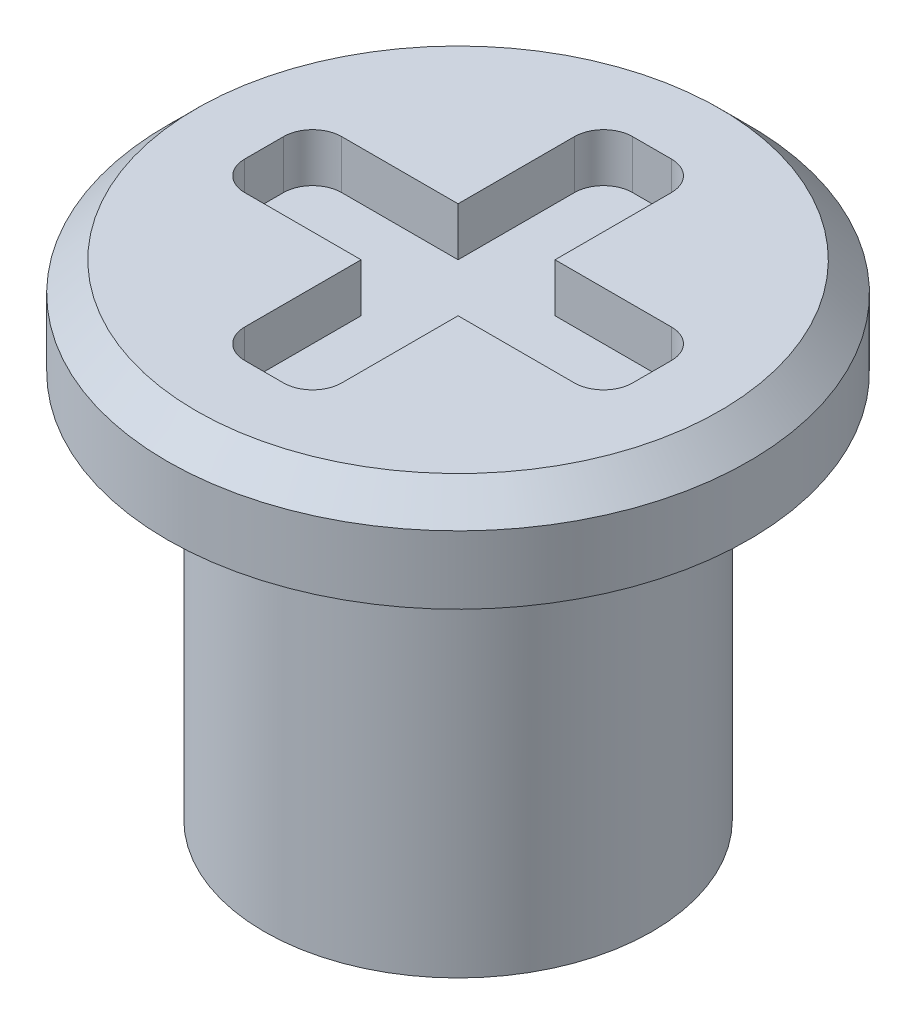
from build123d import *

# Parameters (mm, degrees)
SKETCH1_R           = 1.5
BOSS_EXTRUDE1_DEPTH = 0.5
CUT_EXTRUDE1_DEPTH  = 0.25
CHAMFER1_SIZE       = 0.15
SKETCH3_R           = 1
BOSS_EXTRUDE2_DEPTH = 2


with BuildPart() as part:
    # Sketch1 → Boss-Extrude1 (new body)
    with BuildSketch(Plane(origin=(0, 0, 0), x_dir=(1, 0, 0), z_dir=(0, 1, 0))):
        with Locations(Location((0, 0, 0), (0, 0, 270))):
            Circle(SKETCH1_R)
    extrude(amount=BOSS_EXTRUDE1_DEPTH)

    # Sketch2 → Cut-Extrude1 (cut)
    with BuildSketch(Plane(origin=(0, 0.5, 0), x_dir=(1, 0, 0), z_dir=(0, 1, 0))):
        with BuildLine():
            Line((-0.1, -1), (0.1, -1))
            ThreePointArc((0.1, -1), (0.206066017, -0.956066017), (0.25, -0.85))
            Line((0.25, -0.85), (0.25, -0.25))
            Line((0.25, -0.25), (0.85, -0.25))
            ThreePointArc((0.85, -0.25), (0.956066017, -0.206066017), (1, -0.1))
            Line((1, -0.1), (1, 0.1))
            ThreePointArc((1, 0.1), (0.956066017, 0.206066017), (0.85, 0.25))
            Line((0.85, 0.25), (0.25, 0.25))
            Line((0.25, 0.25), (0.25, 0.85))
            ThreePointArc((0.25, 0.85), (0.206066017, 0.956066017), (0.1, 1))
            Line((0.1, 1), (-0.1, 1))
            ThreePointArc((-0.1, 1), (-0.206066017, 0.956066017), (-0.25, 0.85))
            Line((-0.25, 0.85), (-0.25, 0.25))
            Line((-0.25, 0.25), (-0.85, 0.25))
            ThreePointArc((-0.85, 0.25), (-0.956066017, 0.206066017), (-1, 0.1))
            Line((-1, 0.1), (-1, -0.1))
            ThreePointArc((-1, -0.1), (-0.956066017, -0.206066017), (-0.85, -0.25))
            Line((-0.85, -0.25), (-0.25, -0.25))
            Line((-0.25, -0.25), (-0.25, -0.85))
            ThreePointArc((-0.25, -0.85), (-0.206066017, -0.956066017), (-0.1, -1))
        make_face()
    extrude(amount=-CUT_EXTRUDE1_DEPTH, mode=Mode.SUBTRACT)

    # Chamfer1
    chamfer1_edges = [part.edges().sort_by_distance(p)[0] for p in [
        (0, 0.5, -1.5),
    ]]
    chamfer(chamfer1_edges, length=CHAMFER1_SIZE)

    # Sketch3 → Boss-Extrude2 (add)
    with BuildSketch(Plane.XZ):
        with Locations(Location((0, 0, 0), (0, 0, 90))):
            Circle(SKETCH3_R)
    extrude(amount=BOSS_EXTRUDE2_DEPTH)


solid = part.part
